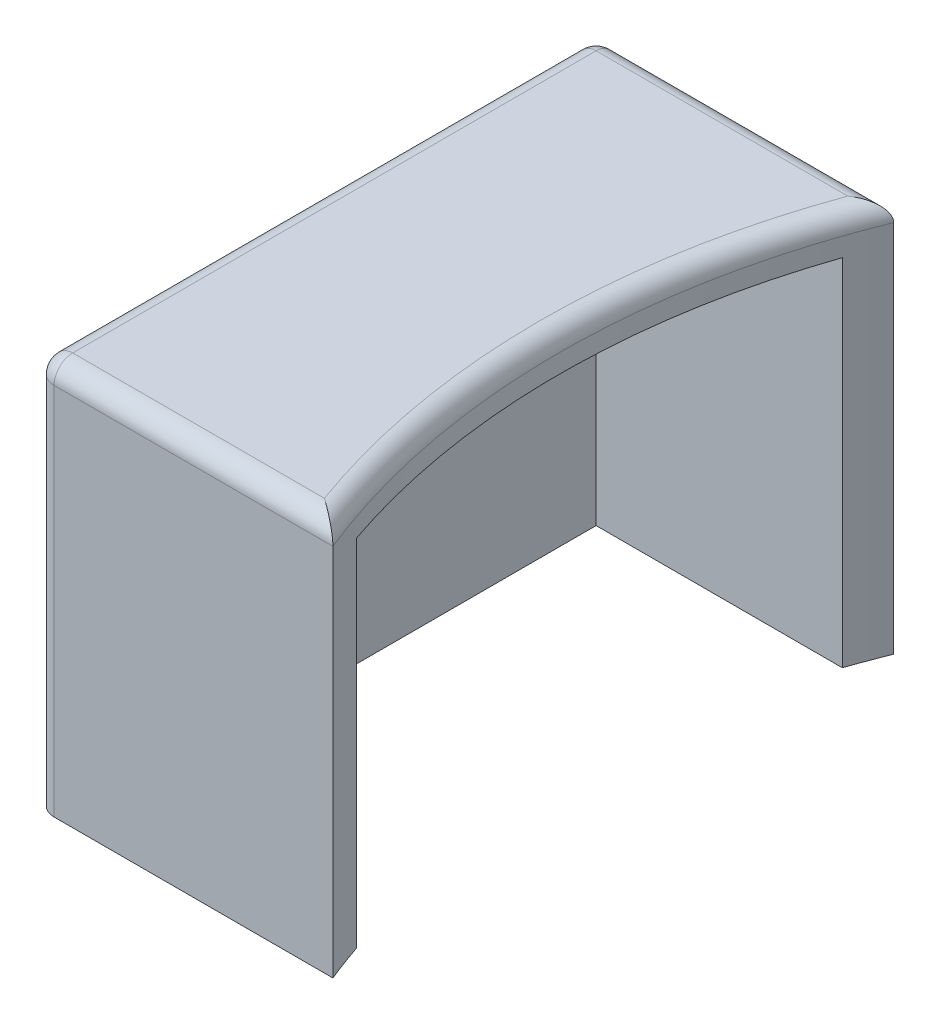
from build123d import *

# Parameters (mm, degrees)
BOSS_EXTRUDE1_DEPTH = 21
SHELL1_T            = -2
FILLET1_R           = 1


with BuildPart() as part:
    # Sketch1 → Boss-Extrude1 (new body)
    with BuildSketch(Plane(origin=(0, 0, 0), x_dir=(1, 0, 0), z_dir=(0, 1, 0))):
        with BuildLine():
            Line((0, 0), (0, 30))
            Line((0, 30), (15.92, 30))
            ThreePointArc((15.92, 30), (13.000920011, 15), (15.92, 0))
            Line((15.92, 0), (0, 0))
        make_face()
    extrude(amount=BOSS_EXTRUDE1_DEPTH)

    # Shell1
    shell1_openings = [part.faces().sort_by_distance(p)[0] for p in [
        (7.00647131, 0, -15),
        (13.000920011, 10.5, -15),
    ]]
    offset(amount=SHELL1_T, openings=shell1_openings, kind=Kind.INTERSECTION)

    # Fillet1
    fillet1_edges = [part.edges().sort_by_distance(p)[0] for p in [
        (7.96, 21, -30),
        (0, 21, -15),
        (7.96, 21, 0),
        (0, 10.5, 0),
        (0, 10.5, -30),
        (13.000920011, 21, -15),
    ]]
    fillet(fillet1_edges, radius=FILLET1_R)


solid = part.part
